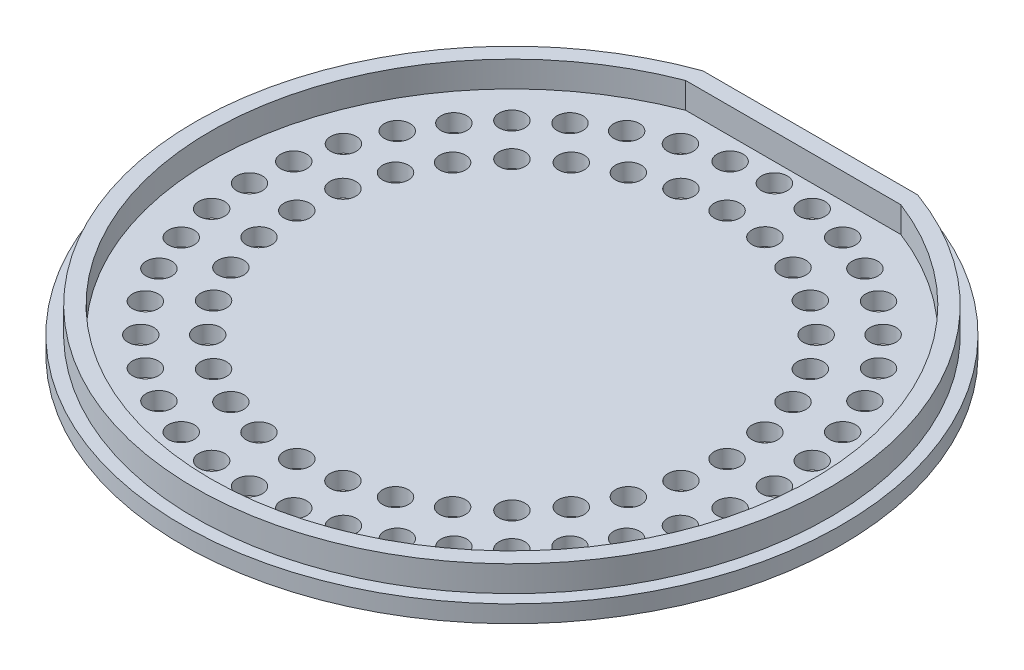
from build123d import *

# Parameters (mm, degrees)
BOSS_EXTRUDE1_DEPTH = 3
SKETCH1_4_R         = 1.5
BOSS_EXTRUDE3_DEPTH = 2
SKETCH2_OUTSIDE_W   = 100.51
SKETCH2_OUTSIDE_H   = 98.431
CUT_EXTRUDE2_DEPTH  = 10


with BuildPart() as part:
    # Sketch1 → Boss-Extrude1 (new body)
    with BuildSketch(Plane(origin=(0, 0, 0), x_dir=(1, 0, 0), z_dir=(0, 1, 0))):
        with BuildLine():
            Line((-12.480384609, 34.660769231), (12.480384609, 34.660769231))
            ThreePointArc((12.480384609, 34.660769231), (0, -36.839230769), (-12.480384609, 34.660769231))
        make_face()
        with BuildLine():
            ThreePointArc((-12.5, 32.691742077), (0, -35), (12.5, 32.691742077))
            Line((12.5, 32.691742077), (-12.5, 32.691742077))
        make_face(mode=Mode.SUBTRACT)
    extrude(amount=BOSS_EXTRUDE1_DEPTH)

    # Sketch1<4> → Boss-Extrude3 (add)
    with BuildSketch(Plane(origin=(0, 0, 0), x_dir=(1, 0, 0), z_dir=(0, 1, 0))):
        with BuildLine():
            Line((12.480384609, 36.42101042), (-12.480384609, 36.42101042))
            ThreePointArc((-12.480384609, 36.42101042), (0, -38.5), (12.480384609, 36.42101042))
        make_face()
        with Locations(Location((0, 30.5, 0), (0, 0, 270))):
            Circle(SKETCH1_4_R, mode=Mode.SUBTRACT)
        with Locations(Location((4.771251184, 30.124494388, 0), (0, 0, 270))):
            Circle(SKETCH1_4_R, mode=Mode.SUBTRACT)
        with Locations(Location((9.425018328, 29.007223747, 0), (0, 0, 270))):
            Circle(SKETCH1_4_R, mode=Mode.SUBTRACT)
        with Locations(Location((13.846710242, 27.175698988, 0), (0, 0, 270))):
            Circle(SKETCH1_4_R, mode=Mode.SUBTRACT)
        with Locations(Location((17.927450195, 24.675018328, 0), (0, 0, 270))):
            Circle(SKETCH1_4_R, mode=Mode.SUBTRACT)
        with Locations(Location((21.566756826, 21.566756826, 0), (0, 0, 270))):
            Circle(SKETCH1_4_R, mode=Mode.SUBTRACT)
        with Locations(Location((24.675018328, 17.927450195, 0), (0, 0, 270))):
            Circle(SKETCH1_4_R, mode=Mode.SUBTRACT)
        with Locations(Location((27.175698988, 13.846710242, 0), (0, 0, 270))):
            Circle(SKETCH1_4_R, mode=Mode.SUBTRACT)
        with Locations(Location((29.007223747, 9.425018328, 0), (0, 0, 270))):
            Circle(SKETCH1_4_R, mode=Mode.SUBTRACT)
        with Locations(Location((30.124494388, 4.771251184, 0), (0, 0, 270))):
            Circle(SKETCH1_4_R, mode=Mode.SUBTRACT)
        with Locations(Location((30.5, 0, 0), (0, 0, 270))):
            Circle(SKETCH1_4_R, mode=Mode.SUBTRACT)
        with Locations(Location((30.124494388, -4.771251184, 0), (0, 0, 270))):
            Circle(SKETCH1_4_R, mode=Mode.SUBTRACT)
        with Locations(Location((29.007223747, -9.425018328, 0), (0, 0, 270))):
            Circle(SKETCH1_4_R, mode=Mode.SUBTRACT)
        with Locations(Location((27.175698988, -13.846710242, 0), (0, 0, 270))):
            Circle(SKETCH1_4_R, mode=Mode.SUBTRACT)
        with Locations(Location((24.675018328, -17.927450195, 0), (0, 0, 270))):
            Circle(SKETCH1_4_R, mode=Mode.SUBTRACT)
        with Locations(Location((21.566756826, -21.566756826, 0), (0, 0, 270))):
            Circle(SKETCH1_4_R, mode=Mode.SUBTRACT)
        with Locations(Location((17.927450195, -24.675018328, 0), (0, 0, 270))):
            Circle(SKETCH1_4_R, mode=Mode.SUBTRACT)
        with Locations(Location((13.846710242, -27.175698988, 0), (0, 0, 270))):
            Circle(SKETCH1_4_R, mode=Mode.SUBTRACT)
        with Locations(Location((9.425018328, -29.007223747, 0), (0, 0, 270))):
            Circle(SKETCH1_4_R, mode=Mode.SUBTRACT)
        with Locations(Location((4.771251184, -30.124494388, 0), (0, 0, 270))):
            Circle(SKETCH1_4_R, mode=Mode.SUBTRACT)
        with Locations(Location((0, -30.5, 0), (0, 0, 270))):
            Circle(SKETCH1_4_R, mode=Mode.SUBTRACT)
        with Locations(Location((-4.771251184, -30.124494388, 0), (0, 0, 270))):
            Circle(SKETCH1_4_R, mode=Mode.SUBTRACT)
        with Locations(Location((-9.425018328, -29.007223747, 0), (0, 0, 270))):
            Circle(SKETCH1_4_R, mode=Mode.SUBTRACT)
        with Locations(Location((-13.846710242, -27.175698988, 0), (0, 0, 270))):
            Circle(SKETCH1_4_R, mode=Mode.SUBTRACT)
        with Locations(Location((-17.927450195, -24.675018328, 0), (0, 0, 270))):
            Circle(SKETCH1_4_R, mode=Mode.SUBTRACT)
        with Locations(Location((-21.566756826, -21.566756826, 0), (0, 0, 270))):
            Circle(SKETCH1_4_R, mode=Mode.SUBTRACT)
        with Locations(Location((-24.675018328, -17.927450195, 0), (0, 0, 270))):
            Circle(SKETCH1_4_R, mode=Mode.SUBTRACT)
        with Locations(Location((-27.175698988, -13.846710242, 0), (0, 0, 270))):
            Circle(SKETCH1_4_R, mode=Mode.SUBTRACT)
        with Locations(Location((-29.007223747, -9.425018328, 0), (0, 0, 270))):
            Circle(SKETCH1_4_R, mode=Mode.SUBTRACT)
        with Locations(Location((-30.124494388, -4.771251184, 0), (0, 0, 270))):
            Circle(SKETCH1_4_R, mode=Mode.SUBTRACT)
        with Locations(Location((-30.5, 0, 0), (0, 0, 270))):
            Circle(SKETCH1_4_R, mode=Mode.SUBTRACT)
        with Locations(Location((-30.124494388, 4.771251184, 0), (0, 0, 270))):
            Circle(SKETCH1_4_R, mode=Mode.SUBTRACT)
        with Locations(Location((-29.007223747, 9.425018328, 0), (0, 0, 270))):
            Circle(SKETCH1_4_R, mode=Mode.SUBTRACT)
        with Locations(Location((-27.175698988, 13.846710242, 0), (0, 0, 270))):
            Circle(SKETCH1_4_R, mode=Mode.SUBTRACT)
        with Locations(Location((-24.675018328, 17.927450195, 0), (0, 0, 270))):
            Circle(SKETCH1_4_R, mode=Mode.SUBTRACT)
        with Locations(Location((-21.566756826, 21.566756826, 0), (0, 0, 270))):
            Circle(SKETCH1_4_R, mode=Mode.SUBTRACT)
        with Locations(Location((-17.927450195, 24.675018328, 0), (0, 0, 270))):
            Circle(SKETCH1_4_R, mode=Mode.SUBTRACT)
        with Locations(Location((-13.846710242, 27.175698988, 0), (0, 0, 270))):
            Circle(SKETCH1_4_R, mode=Mode.SUBTRACT)
        with Locations(Location((-9.425018328, 29.007223747, 0), (0, 0, 270))):
            Circle(SKETCH1_4_R, mode=Mode.SUBTRACT)
        with Locations(Location((-4.771251184, 30.124494388, 0), (0, 0, 270))):
            Circle(SKETCH1_4_R, mode=Mode.SUBTRACT)
        with Locations(Location((0, 25, 0), (0, 0, 270))):
            Circle(SKETCH1_4_R, mode=Mode.SUBTRACT)
        with Locations(Location((4.87725805, 24.51963201, 0), (0, 0, 270))):
            Circle(SKETCH1_4_R, mode=Mode.SUBTRACT)
        with Locations(Location((9.567085809, 23.096988313, 0), (0, 0, 270))):
            Circle(SKETCH1_4_R, mode=Mode.SUBTRACT)
        with Locations(Location((13.889255825, 20.786740308, 0), (0, 0, 270))):
            Circle(SKETCH1_4_R, mode=Mode.SUBTRACT)
        with Locations(Location((17.67766953, 17.67766953, 0), (0, 0, 270))):
            Circle(SKETCH1_4_R, mode=Mode.SUBTRACT)
        with Locations(Location((20.786740308, 13.889255825, 0), (0, 0, 270))):
            Circle(SKETCH1_4_R, mode=Mode.SUBTRACT)
        with Locations(Location((23.096988313, 9.567085809, 0), (0, 0, 270))):
            Circle(SKETCH1_4_R, mode=Mode.SUBTRACT)
        with Locations(Location((24.51963201, 4.87725805, 0), (0, 0, 270))):
            Circle(SKETCH1_4_R, mode=Mode.SUBTRACT)
        with Locations(Location((25, 0, 0), (0, 0, 270))):
            Circle(SKETCH1_4_R, mode=Mode.SUBTRACT)
        with Locations(Location((24.51963201, -4.87725805, 0), (0, 0, 270))):
            Circle(SKETCH1_4_R, mode=Mode.SUBTRACT)
        with Locations(Location((23.096988313, -9.567085809, 0), (0, 0, 270))):
            Circle(SKETCH1_4_R, mode=Mode.SUBTRACT)
        with Locations(Location((20.786740308, -13.889255825, 0), (0, 0, 270))):
            Circle(SKETCH1_4_R, mode=Mode.SUBTRACT)
        with Locations(Location((17.67766953, -17.67766953, 0), (0, 0, 270))):
            Circle(SKETCH1_4_R, mode=Mode.SUBTRACT)
        with Locations(Location((13.889255825, -20.786740308, 0), (0, 0, 270))):
            Circle(SKETCH1_4_R, mode=Mode.SUBTRACT)
        with Locations(Location((9.567085809, -23.096988313, 0), (0, 0, 270))):
            Circle(SKETCH1_4_R, mode=Mode.SUBTRACT)
        with Locations(Location((4.87725805, -24.51963201, 0), (0, 0, 270))):
            Circle(SKETCH1_4_R, mode=Mode.SUBTRACT)
        with Locations(Location((0, -25, 0), (0, 0, 270))):
            Circle(SKETCH1_4_R, mode=Mode.SUBTRACT)
        with Locations(Location((-4.87725805, -24.51963201, 0), (0, 0, 270))):
            Circle(SKETCH1_4_R, mode=Mode.SUBTRACT)
        with Locations(Location((-9.567085809, -23.096988313, 0), (0, 0, 270))):
            Circle(SKETCH1_4_R, mode=Mode.SUBTRACT)
        with Locations(Location((-13.889255825, -20.786740308, 0), (0, 0, 270))):
            Circle(SKETCH1_4_R, mode=Mode.SUBTRACT)
        with Locations(Location((-17.67766953, -17.67766953, 0), (0, 0, 270))):
            Circle(SKETCH1_4_R, mode=Mode.SUBTRACT)
        with Locations(Location((-20.786740308, -13.889255825, 0), (0, 0, 270))):
            Circle(SKETCH1_4_R, mode=Mode.SUBTRACT)
        with Locations(Location((-23.096988313, -9.567085809, 0), (0, 0, 270))):
            Circle(SKETCH1_4_R, mode=Mode.SUBTRACT)
        with Locations(Location((-24.51963201, -4.87725805, 0), (0, 0, 270))):
            Circle(SKETCH1_4_R, mode=Mode.SUBTRACT)
        with Locations(Location((-25, 0, 0), (0, 0, 270))):
            Circle(SKETCH1_4_R, mode=Mode.SUBTRACT)
        with Locations(Location((-24.51963201, 4.87725805, 0), (0, 0, 270))):
            Circle(SKETCH1_4_R, mode=Mode.SUBTRACT)
        with Locations(Location((-23.096988313, 9.567085809, 0), (0, 0, 270))):
            Circle(SKETCH1_4_R, mode=Mode.SUBTRACT)
        with Locations(Location((-20.786740308, 13.889255825, 0), (0, 0, 270))):
            Circle(SKETCH1_4_R, mode=Mode.SUBTRACT)
        with Locations(Location((-17.67766953, 17.67766953, 0), (0, 0, 270))):
            Circle(SKETCH1_4_R, mode=Mode.SUBTRACT)
        with Locations(Location((-13.889255825, 20.786740308, 0), (0, 0, 270))):
            Circle(SKETCH1_4_R, mode=Mode.SUBTRACT)
        with Locations(Location((-9.567085809, 23.096988313, 0), (0, 0, 270))):
            Circle(SKETCH1_4_R, mode=Mode.SUBTRACT)
        with Locations(Location((-4.87725805, 24.51963201, 0), (0, 0, 270))):
            Circle(SKETCH1_4_R, mode=Mode.SUBTRACT)
    extrude(amount=-BOSS_EXTRUDE3_DEPTH)

    # Sketch2 outside → Cut-Extrude2 (cut)
    with BuildSketch(Plane(origin=(0, 0, 0), x_dir=(1, 0, 0), z_dir=(0, 1, 0))):
        with Locations((0, -1.0395)):
            Rectangle(SKETCH2_OUTSIDE_W, SKETCH2_OUTSIDE_H)
        with BuildLine():
            Line((12.447023908, 36.22101042), (-12.447023908, 36.22101042))
            ThreePointArc((-12.447023908, 36.22101042), (0, -38.3), (12.447023908, 36.22101042))
        make_face(mode=Mode.SUBTRACT)
    extrude(amount=-CUT_EXTRUDE2_DEPTH, mode=Mode.SUBTRACT)


solid = part.part
